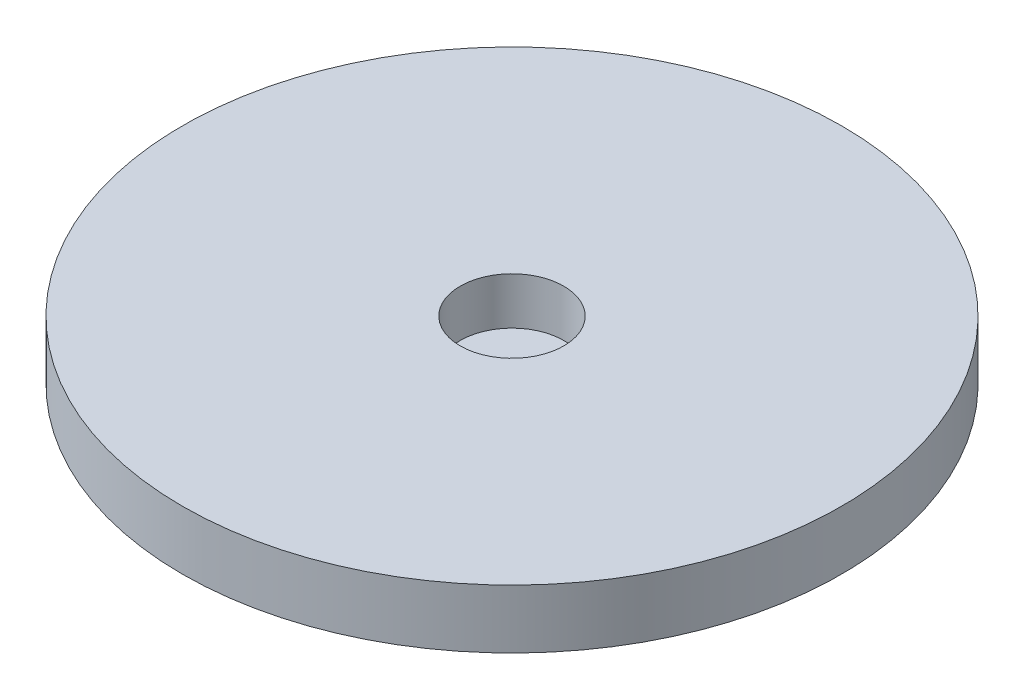
from build123d import *

# Parameters (mm, degrees)
SKETCH1_R           = 70
BOSS_EXTRUDE2_DEPTH = 12.5
SKETCH3_R           = 11
CUT_EXTRUDE1_DEPTH  = 10


with BuildPart() as part:
    # Sketch1 → Boss-Extrude2 (new body)
    with BuildSketch(Plane(origin=(0, 0, 0), x_dir=(1, 0, 0), z_dir=(0, 1, 0))):
        with Locations(Location((0, 0, 0), (0, 0, 270))):
            Circle(SKETCH1_R)
    extrude(amount=BOSS_EXTRUDE2_DEPTH)

    # Sketch3 → Cut-Extrude1 (cut)
    with BuildSketch(Plane(origin=(0, 12.5, 0), x_dir=(1, 0, 0), z_dir=(0, 1, 0))):
        with Locations(Location((0, 0, 0), (0, 0, 270))):
            Circle(SKETCH3_R)
    extrude(amount=-CUT_EXTRUDE1_DEPTH, mode=Mode.SUBTRACT)


solid = part.part
